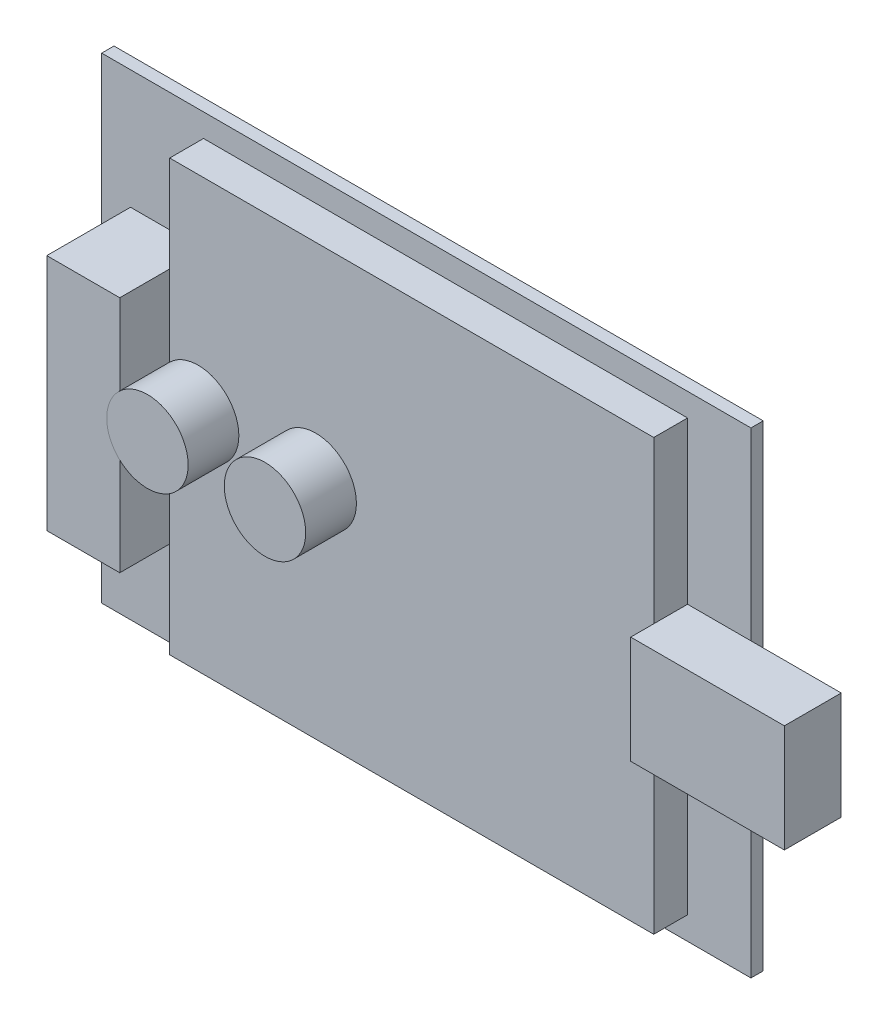
from build123d import *

# Parameters (mm, degrees)
SKETCH1_W             = 84.5
SKETCH1_H             = 62
PCB_DEPTH             = 1.6
SKETCH2_W             = 9.5
SKETCH2_H             = 31
TERMINAL_BLOCK_DEPTH  = 10.9
SKETCH3_W             = 9.5
SKETCH3_H             = 31
TERMINAL_PINS_DEPTH   = 2.5
SKETCH4_W             = 63
SKETCH4_H             = 56
COMPONENTS_DEPTH      = 4.4
SKETCH5_W             = 20
SKETCH5_H             = 14
INPUT_CONNECTOR_DEPTH = 7.4
SKETCH6_R             = 5.3
CAP_1_DEPTH           = 11
SKETCH7_R             = 5.3
CAP_2_DEPTH           = 11


with BuildPart() as part:
    # Sketch1 → PCB (new body)
    with BuildSketch(Plane.XY):
        Rectangle(SKETCH1_W, SKETCH1_H)
    extrude(amount=PCB_DEPTH)

    # Sketch2 → Terminal_block (add)
    with BuildSketch(Plane.XY.offset(1.6)):
        with Locations((-33.75, 0)):
            Rectangle(SKETCH2_W, SKETCH2_H)
    extrude(amount=TERMINAL_BLOCK_DEPTH)

    # Sketch3 → Terminal_pins (add)
    with BuildSketch(Plane.XY.offset(-2.5)):
        with Locations((-33.75, 0)):
            Rectangle(SKETCH3_W, SKETCH3_H)
    extrude(amount=TERMINAL_PINS_DEPTH)

    # Sketch4 → Components (add)
    with BuildSketch(Plane.XY.offset(1.6)):
        with Locations((2.5, 0)):
            Rectangle(SKETCH4_W, SKETCH4_H)
    extrude(amount=COMPONENTS_DEPTH)

    # Sketch5 → Input_connector (add)
    with BuildSketch(Plane.XY.offset(1.6)):
        with Locations((44, 0)):
            Rectangle(SKETCH5_W, SKETCH5_H)
    extrude(amount=INPUT_CONNECTOR_DEPTH)

    # Sketch6 → Cap_1 (add)
    with BuildSketch(Plane.XY.offset(1.6)):
        with Locations(Location((-25.3, 1.2, 0), (0, 0, 225.724178288))):
            Circle(SKETCH6_R)
    extrude(amount=CAP_1_DEPTH)

    # Sketch7 → Cap_2 (add)
    with BuildSketch(Plane.XY.offset(1.6)):
        with Locations((-10, 1.2)):
            Circle(SKETCH7_R)
    extrude(amount=CAP_2_DEPTH)


solid = part.part
